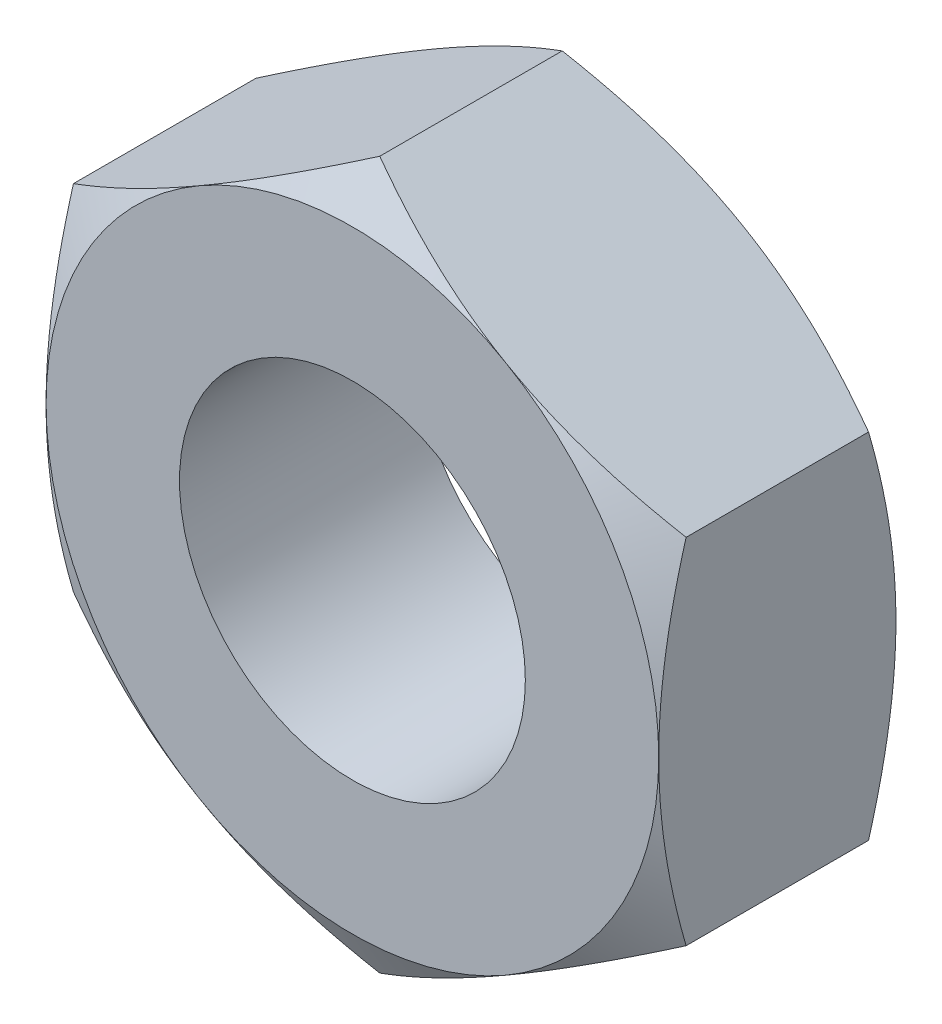
from build123d import *

# Parameters (mm, degrees)
EXTRUDE_1_DEPTH          = 2.4
SKETCH_2_OUTSIDE_W       = 15.35
SKETCH_2_OUTSIDE_H       = 16.31
SKETCH_2_OUTSIDE_R       = 3.1
CUT_EXTRUDE_2_DEPTH      = 1.5
CUT_EXTRUDE_2_DRAFT      = -60
MIRROR_1_COPY_1_SKETCH_W = 15.35
MIRROR_1_COPY_1_SKETCH_H = 16.31
MIRROR_1_COPY_1_SKETCH_R = 3.1
MIRROR_1_COPY_1_DEPTH    = 1.5
MIRROR_1_COPY_1_DRAFT    = -60
SKETCH_3_R               = 1.75
CUT_EXTRUDE_3_DEPTH      = 6.30879773


with BuildPart() as part:
    # 草圖1 → 伸長1 (new body)
    with BuildSketch(Plane.XY):
        Polygon((0, 3.579571669), (-3.1, 1.789785834), (-3.1, -1.789785834), (0, -3.579571669), (3.1, -1.789785834), (3.1, 1.789785834), align=None)
    extrude(amount=EXTRUDE_1_DEPTH)


with BuildPart() as cut_extrude_2_tool:
    # 草圖2 outside → 伸長2 (with draft: the straight prism first)
    with BuildSketch(Plane.XY.offset(2.4)):
        Rectangle(SKETCH_2_OUTSIDE_W, SKETCH_2_OUTSIDE_H)
        Circle(SKETCH_2_OUTSIDE_R, mode=Mode.SUBTRACT)
    extrude(amount=-CUT_EXTRUDE_2_DEPTH)
    # 伸長2: the draft: its side faces are tilted about the plane it starts from
    cut_extrude_2_sides = [cut_extrude_2_tool.faces().sort_by_distance(p)[0] for p in [
        (0, -8.155, 1.65),
        (7.675, 0, 1.65),
        (0, 8.155, 1.65),
        (-7.675, 0, 1.65),
        (-3.1, 0, 1.65),
    ]]
    draft(cut_extrude_2_sides, Plane.XY.offset(2.4), CUT_EXTRUDE_2_DRAFT)


with BuildPart() as part_1:
    add(part.part)

    # 伸長2: cut by cut_extrude_2_tool
    add(cut_extrude_2_tool.part, mode=Mode.SUBTRACT)


with BuildPart() as mirror_1_copy_1_tool:
    # 鏡射1 copy 1 sketch → 鏡射1 copy 1 (with draft: the straight prism first)
    with BuildSketch(Plane(origin=(0, 0, 0), x_dir=(1, 0, 0), z_dir=(0, 0, -1))):
        Rectangle(MIRROR_1_COPY_1_SKETCH_W, MIRROR_1_COPY_1_SKETCH_H)
        Circle(MIRROR_1_COPY_1_SKETCH_R, mode=Mode.SUBTRACT)
    extrude(amount=-MIRROR_1_COPY_1_DEPTH)
    # 鏡射1 copy 1: the draft: its side faces are tilted about the plane it starts from
    mirror_1_copy_1_sides = [mirror_1_copy_1_tool.faces().sort_by_distance(p)[0] for p in [
        (0, -8.155, 0.75),
        (7.675, 0, 0.75),
        (0, 8.155, 0.75),
        (-7.675, 0, 0.75),
        (-3.1, 0, 0.75),
    ]]
    draft(mirror_1_copy_1_sides, Plane(origin=(0, 0, 0), x_dir=(1, 0, 0), z_dir=(0, 0, -1)), MIRROR_1_COPY_1_DRAFT)


with BuildPart() as part_2:
    add(part_1.part)

    # 鏡射1 copy 1: cut by mirror_1_copy_1_tool
    add(mirror_1_copy_1_tool.part, mode=Mode.SUBTRACT)

    # 草圖3 → 伸長3 (cut, through all)
    with BuildSketch(Plane.XY.offset(2.4)):
        Circle(SKETCH_3_R)
    extrude(amount=-CUT_EXTRUDE_3_DEPTH, mode=Mode.SUBTRACT)


solid = part_2.part
